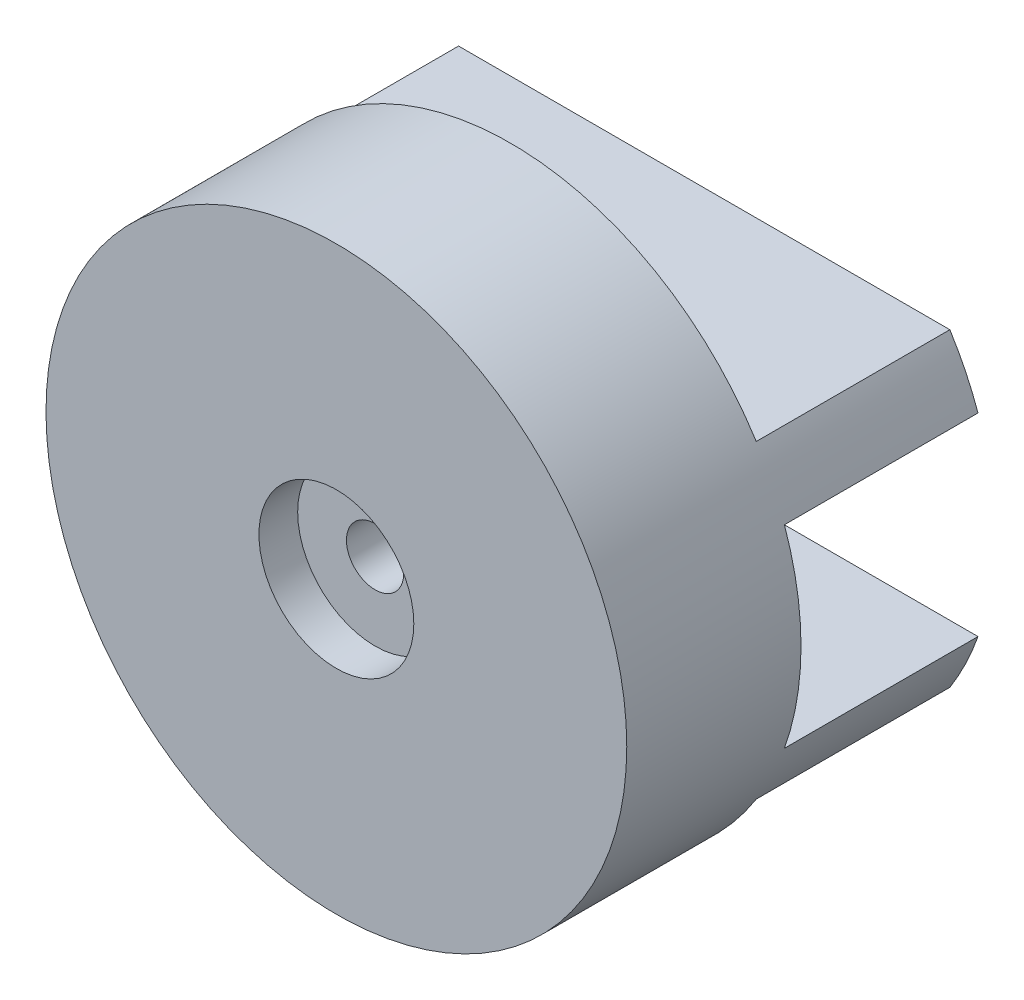
from build123d import *
from build123d.topology import SkipClean

# Parameters (mm, degrees)
CROQUIS1_R              = 75
SALIENTE_EXTRUIR1_DEPTH = 15
SALIENTE_EXTRUIR2_START = 60
SALIENTE_EXTRUIR2_DEPTH = 60
CROQUIS3_R              = 75
CROQUIS3_R_2            = 60
SALIENTE_EXTRUIR3_DEPTH = 20
CROQUIS4_R              = 25
CORTAR_EXTRUIR1_DEPTH   = 20
SALIENTE_EXTRUIR4_START = -30
CROQUIS5_R              = 60
CROQUIS5_R_2            = 30
SALIENTE_EXTRUIR4_DEPTH = 30
CROQUIS6_R              = 30
CROQUIS6_R_2            = 25
SALIENTE_EXTRUIR5_DEPTH = 10
SALIENTE_EXTRUIR6_START = -35
CROQUIS7_R              = 30
CROQUIS7_R_2            = 20
SALIENTE_EXTRUIR6_DEPTH = 35
CROQUIS8_R              = 20
CROQUIS8_R_2            = 7.4
SALIENTE_EXTRUIR7_DEPTH = 25
SALIENTE_EXTRUIR9_START = 10
CROQUIS9_R              = 7.400002037
SALIENTE_EXTRUIR9_DEPTH = 10


with BuildPart() as part:
    # Croquis1 → Saliente-Extruir1 (new body)
    with BuildSketch(Plane.XY):
        Circle(CROQUIS1_R)
    extrude(amount=SALIENTE_EXTRUIR1_DEPTH)

    # Croquis2 → Saliente-Extruir2 (add)
    with SkipClean():  # the faces are left unmerged after this step: merging them gives an invalid solid
        with BuildSketch(Plane(origin=(0, 0, 0), x_dir=(-1, 0, 0), z_dir=(0, 0, -1)).offset(SALIENTE_EXTRUIR2_START)):
            with BuildLine():
                Line((-70.710678119, 25), (0, 25))
                Line((0, 25), (0, 40))
                Line((0, 40), (-63.442887702, 40))
                ThreePointArc((-63.442887702, 40), (-67.494776136, 32.70252581), (-70.710678119, 25))
            make_face()
            with BuildLine():
                Line((0, 40), (0, 25))
                Line((0, 25), (70.710678119, 25))
                ThreePointArc((70.710678119, 25), (67.494776136, 32.70252581), (63.442887702, 40))
                Line((63.442887702, 40), (0, 40))
            make_face()
            with BuildLine():
                Line((-70.710678119, 25), (0, 25))
                Line((0, 25), (0, 40))
                Line((0, 40), (-63.442887702, 40))
                ThreePointArc((-63.442887702, 40), (-67.494776136, 32.70252581), (-70.710678119, 25))
            make_face()
            with BuildLine():
                Line((0, -40), (0, -25))
                Line((0, -25), (-70.710678119, -25))
                ThreePointArc((-70.710678119, -25), (-67.494776136, -32.70252581), (-63.442887702, -40))
                Line((-63.442887702, -40), (0, -40))
            make_face()
            with BuildLine():
                Line((70.710678119, -25), (0, -25))
                Line((0, -25), (0, -40))
                Line((0, -40), (63.442887702, -40))
                ThreePointArc((63.442887702, -40), (67.494776136, -32.70252581), (70.710678119, -25))
            make_face()
            with BuildLine():
                Line((0, -40), (0, -25))
                Line((0, -25), (-70.710678119, -25))
                ThreePointArc((-70.710678119, -25), (-67.494776136, -32.70252581), (-63.442887702, -40))
                Line((-63.442887702, -40), (0, -40))
            make_face()
            with BuildLine():
                Line((70.710678119, -25), (0, -25))
                Line((0, -25), (0, -40))
                Line((0, -40), (63.442887702, -40))
                ThreePointArc((63.442887702, -40), (67.494776136, -32.70252581), (70.710678119, -25))
            make_face()
        extrude(amount=-SALIENTE_EXTRUIR2_DEPTH)

    # Croquis3 → Saliente-Extruir3 (add)
    with SkipClean():  # the faces are left unmerged after this step: merging them gives an invalid solid
        with BuildSketch(Plane.XY.offset(15)):
            with Locations(Location((0, 0, 0), (0, 0, 160.528779366))):
                Circle(CROQUIS3_R)
            Circle(CROQUIS3_R_2, mode=Mode.SUBTRACT)
        extrude(amount=SALIENTE_EXTRUIR3_DEPTH)

    # Croquis4 → Cortar-Extruir1 (cut)
    with SkipClean():  # the faces are left unmerged after this step: merging them gives an invalid solid
        with BuildSketch(Plane.XY.offset(15)):
            Circle(CROQUIS4_R)
        extrude(amount=-CORTAR_EXTRUIR1_DEPTH, mode=Mode.SUBTRACT)

    # Croquis5 → Saliente-Extruir4 (add)
    with SkipClean():  # the faces are left unmerged after this step: merging them gives an invalid solid
        with BuildSketch(Plane.XY.offset(35).offset(SALIENTE_EXTRUIR4_START)):
            Circle(CROQUIS5_R)
            Circle(CROQUIS5_R_2, mode=Mode.SUBTRACT)
        extrude(amount=SALIENTE_EXTRUIR4_DEPTH)

    # Croquis6 → Saliente-Extruir5 (add)
    with SkipClean():  # the faces are left unmerged after this step: merging them gives an invalid solid
        with BuildSketch(Plane.XY.offset(15)):
            Circle(CROQUIS6_R)
            Circle(CROQUIS6_R_2, mode=Mode.SUBTRACT)
        extrude(amount=SALIENTE_EXTRUIR5_DEPTH)

    # Croquis7 → Saliente-Extruir6 (add)
    with SkipClean():  # the faces are left unmerged after this step: merging them gives an invalid solid
        with BuildSketch(Plane.XY.offset(35).offset(SALIENTE_EXTRUIR6_START)):
            Circle(CROQUIS7_R)
            Circle(CROQUIS7_R_2, mode=Mode.SUBTRACT)
        extrude(amount=SALIENTE_EXTRUIR6_DEPTH)

    # Croquis8 → Saliente-Extruir7 (add)
    with SkipClean():  # the faces are left unmerged after this step: merging them gives an invalid solid
        with BuildSketch(Plane(origin=(0, 0, 0), x_dir=(-1, 0, 0), z_dir=(0, 0, -1))):
            with Locations(Location((0, 0, 0), (0, 0, 180))):
                Circle(CROQUIS8_R)
            Circle(CROQUIS8_R_2, mode=Mode.SUBTRACT)
        extrude(amount=-SALIENTE_EXTRUIR7_DEPTH)

    # Croquis9 → Saliente-Extruir9 (add)
    # profile 1 of 3: a face of its own
    with SkipClean():  # the faces are left unmerged after this step: merging them gives an invalid solid
        with BuildSketch(Plane(origin=(0, 0, 0), x_dir=(-1, 0, 0), z_dir=(0, 0, -1)).offset(SALIENTE_EXTRUIR9_START)):
            with BuildLine():
                Line((-63.442887702, 40), (63.442887702, 40))
                ThreePointArc((63.442887702, 40), (0, 75), (-63.442887702, 40))
            make_face()
        # profile 2 of 3: a face of its own
        with BuildSketch(Plane(origin=(0, 0, 0), x_dir=(-1, 0, 0), z_dir=(0, 0, -1)).offset(SALIENTE_EXTRUIR9_START)):
            with BuildLine():
                Line((-70.710678119, 25), (70.710678119, 25))
                ThreePointArc((70.710678119, 25), (74.999999766, 0), (70.710678119, -25))
                Line((70.710678119, -25), (-70.710678119, -25))
                ThreePointArc((-70.710678119, -25), (-75, 0), (-70.710678119, 25))
            make_face()
            with Locations((-4.084e-06, 0)):
                Circle(CROQUIS9_R, mode=Mode.SUBTRACT)
        # profile 3 of 3: a face of its own
        with BuildSketch(Plane(origin=(0, 0, 0), x_dir=(-1, 0, 0), z_dir=(0, 0, -1)).offset(SALIENTE_EXTRUIR9_START)):
            with BuildLine():
                Line((-63.442887702, -40), (63.442887702, -40))
                ThreePointArc((63.442887702, -40), (0, -75), (-63.442887702, -40))
            make_face()
        extrude(amount=-SALIENTE_EXTRUIR9_DEPTH)


solid = part.part
